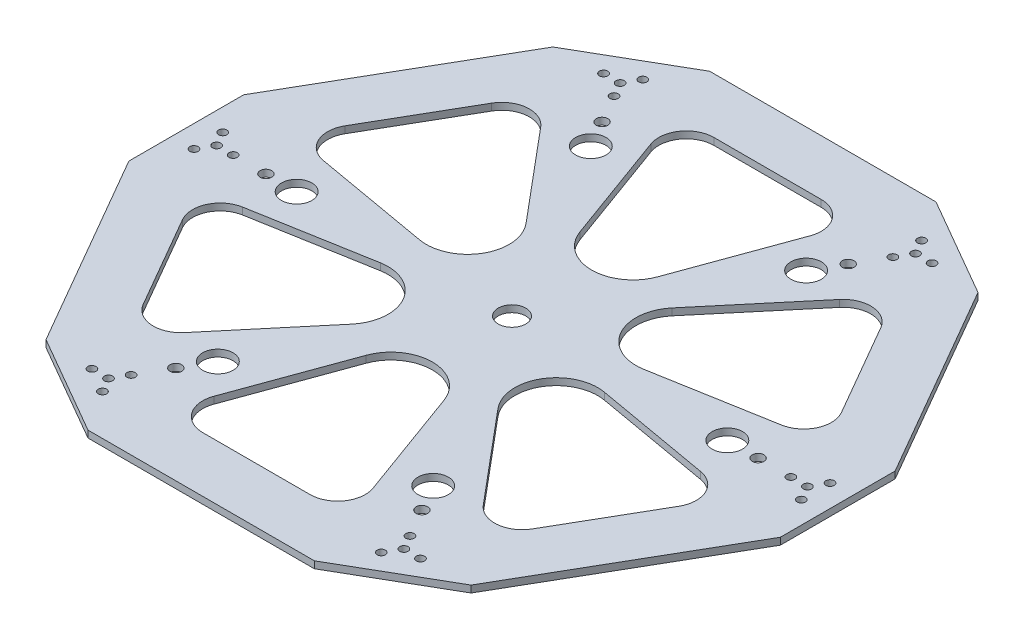
from build123d import *

# Parameters (mm, degrees)
SKETCH_2_R               = 5
EXTRUDE_1_DEPTH          = 2.5
EXTRUDE_2_DEPTH          = 2.5
SKETCH_5_R               = 2.1
CUT_EXTRUDE_2_DEPTH      = 10
CUT_EXTRUDE_3_DEPTH      = 10
EXTRUDE_3_DEPTH          = 2.5
SKETCH_11_R              = 1.5
CUT_EXTRUDE_4_DEPTH      = 167.76405488
PATTERN_CIRCULAR_1_COUNT = 6
CUT_EXTRUDE_12_DEPTH     = 2.5
SKETCH_13_R              = 5.5
CUT_EXTRUDE_13_DEPTH     = 10
SKETCH_14_R              = 10
CUT_EXTRUDE_14_DEPTH     = 10
PATTERN_CIRCULAR_2_COUNT = 6


with BuildPart() as part:
    # 草图2 → 凸台-拉伸1 (new body)
    with BuildSketch(Plane(origin=(0, 0, 0), x_dir=(1, 0, 0), z_dir=(0, 1, 0))):
        Polygon((-54.5, 0), (-27.25, -47.198384506), (27.25, -47.198384506), (54.5, 0), (27.25, 47.198384506), (-27.25, 47.198384506), align=None)
        with Locations(Location((0, 0, 0), (0, 0, 270))):
            Circle(SKETCH_2_R, mode=Mode.SUBTRACT)
    extrude(amount=EXTRUDE_1_DEPTH)

    # 草图4 → 凸台-拉伸2 (add)
    with BuildSketch(Plane(origin=(0, 2.5, 0), x_dir=(1, 0, 0), z_dir=(0, 1, 0))):
        Polygon((-100.688021535, 0), (-50.344010768, -87.198384506), (50.344010768, -87.198384506), (100.688021535, 0), (50.344010768, 87.198384506), (-50.344010768, 87.198384506), align=None)
        Polygon((-54.5, 0), (-27.25, -47.198384506), (27.25, -47.198384506), (54.5, 0), (27.25, 47.198384506), (-27.25, 47.198384506), align=None, mode=Mode.SUBTRACT)
    extrude(amount=-EXTRUDE_2_DEPTH)

    # 草图5 → 切除-拉伸2 (cut)
    with BuildSketch(Plane(origin=(0, 2.5, 0), x_dir=(1, 0, 0), z_dir=(0, 1, 0))):
        with Locations(Location((-44.570508076, 77.198384506, 0), (0, 0, 270))):
            Circle(SKETCH_5_R)
        with Locations(Location((44.570508076, 77.198384506, 0), (0, 0, 270))):
            Circle(SKETCH_5_R)
        with Locations(Location((89.141016151, 0, 0), (0, 0, 270))):
            Circle(SKETCH_5_R)
        with Locations(Location((44.570508076, -77.198384506, 0), (0, 0, 270))):
            Circle(SKETCH_5_R)
        with Locations(Location((-44.570508076, -77.198384506, 0), (0, 0, 270))):
            Circle(SKETCH_5_R)
        with Locations(Location((-89.141016151, 0, 0), (0, 0, 270))):
            Circle(SKETCH_5_R)
    extrude(amount=-CUT_EXTRUDE_2_DEPTH, mode=Mode.SUBTRACT)

    # 草图8 → 切除-拉伸3 (cut)
    with BuildSketch(Plane(origin=(0, 2.5, 0), x_dir=(1, 0, 0), z_dir=(0, 1, 0))):
        with BuildLine():
            ThreePointArc((-53.230762082, 82.198384561), (-49.57050806, 85.858638553), (-44.570508102, 87.198384506))
            Line((-44.570508102, 87.198384506), (-50.344010768, 87.198384506))
            Line((-50.344010768, 87.198384506), (-53.230762082, 82.198384561))
        make_face()
        with BuildLine():
            ThreePointArc((-44.570508102, 87.198384506), (-41.187416216, 86.608734631), (-38.203292274, 84.909322383))
            ThreePointArc((-38.203292274, 84.909322383), (-39.526928503, 86.034926004), (-40.817417051, 87.198384506))
            Line((-40.817417051, 87.198384506), (-44.570508102, 87.198384506))
        make_face()
        with BuildLine():
            ThreePointArc((-55.107307626, 78.948112336), (-54.74496737, 77.248787672), (-54.431984218, 75.539683719))
            ThreePointArc((-54.431984218, 75.539683719), (-54.411656187, 78.973716546), (-53.230762082, 82.198384561))
            Line((-53.230762082, 82.198384561), (-55.107307626, 78.948112336))
        make_face()
        with BuildLine():
            ThreePointArc((-40.817417051, 87.198384506), (-39.526928503, 86.034926004), (-38.203292274, 84.909322383))
            ThreePointArc((-38.203292274, 84.909322383), (1.369e-06, 71.174951736), (38.203294385, 84.909324126))
            ThreePointArc((38.203294385, 84.909324126), (39.526929533, 86.034926906), (40.817417051, 87.198384506))
            Line((40.817417051, 87.198384506), (-40.817417051, 87.198384506))
        make_face()
        with BuildLine():
            ThreePointArc((60, 131.174951736), (-23.989111873, 186.17061076), (-40.817417051, 87.198384506))
            Line((-40.817417051, 87.198384506), (40.817417051, 87.198384506))
            ThreePointArc((40.817417051, 87.198384506), (54.995659024, 107.185839862), (60, 131.174951736))
        make_face()
        with BuildLine():
            ThreePointArc((55.107307626, 78.948112336), (54.744967326, 77.248787452), (54.431984143, 75.539683277))
            ThreePointArc((54.431984143, 75.539683277), (61.639316282, 35.587475927), (92.635276654, 9.369639456))
            ThreePointArc((92.635276654, 9.369639456), (94.271895943, 8.78613873), (95.924724677, 8.25027217))
            Line((95.924724677, 8.25027217), (55.107307626, 78.948112336))
        make_face()
        with BuildLine():
            ThreePointArc((173.600840543, 65.587475868), (120.323489759, 125.209669618), (55.107307626, 78.948112336))
            Line((55.107307626, 78.948112336), (95.924724677, 8.25027217))
            ThreePointArc((95.924724677, 8.25027217), (149.23392242, 17.314466059), (173.600840543, 65.587475868))
        make_face()
        with BuildLine():
            ThreePointArc((95.924724677, -8.25027217), (94.271895905, -8.786138743), (92.635276579, -9.369639484))
            ThreePointArc((92.635276579, -9.369639484), (61.639316268, -35.587475951), (54.431984139, -75.539683251))
            ThreePointArc((54.431984139, -75.539683251), (54.744967324, -77.248787439), (55.107307626, -78.948112336))
            Line((55.107307626, -78.948112336), (95.924724677, -8.25027217))
        make_face()
        with BuildLine():
            ThreePointArc((173.600840543, -65.587475868), (149.23392242, -17.314466059), (95.924724677, -8.25027217))
            Line((95.924724677, -8.25027217), (55.107307626, -78.948112336))
            ThreePointArc((55.107307626, -78.948112336), (120.323489759, -125.209669618), (173.600840543, -65.587475868))
        make_face()
        with BuildLine():
            ThreePointArc((40.817417051, -87.198384506), (39.526928757, -86.034926226), (38.203292795, -84.909322813))
            ThreePointArc((38.203292795, -84.909322813), (2.5e-07, -71.174951736), (-38.20329241, -84.909322495))
            ThreePointArc((-38.20329241, -84.909322495), (-39.52692857, -86.034926062), (-40.817417051, -87.198384506))
            Line((-40.817417051, -87.198384506), (40.817417051, -87.198384506))
        make_face()
        with BuildLine():
            ThreePointArc((60, -131.174951736), (54.995659024, -107.185839862), (40.817417051, -87.198384506))
            Line((40.817417051, -87.198384506), (-40.817417051, -87.198384506))
            ThreePointArc((-40.817417051, -87.198384506), (-23.989111873, -186.17061076), (60, -131.174951736))
        make_face()
        with BuildLine():
            ThreePointArc((-53.600840543, -65.587475868), (-64.316290117, -31.367115127), (-92.635276851, -9.369639383))
            ThreePointArc((-92.635276851, -9.369639383), (-94.271896042, -8.786138696), (-95.924724677, -8.25027217))
            Line((-95.924724677, -8.25027217), (-55.107307626, -78.948112336))
            ThreePointArc((-55.107307626, -78.948112336), (-54.744967314, -77.248787392), (-54.431984123, -75.539683157))
            ThreePointArc((-54.431984123, -75.539683157), (-53.808987481, -70.580902286), (-53.600840543, -65.587475868))
        make_face()
        with BuildLine():
            Line((-55.107307626, -78.948112336), (-95.924724677, -8.25027217))
            ThreePointArc((-95.924724677, -8.25027217), (-165.56236477, -95.587475868), (-55.107307626, -78.948112336))
        make_face()
        with BuildLine():
            ThreePointArc((-53.600840543, 65.587475868), (-53.808987505, 70.58090257), (-54.431984218, 75.539683719))
            ThreePointArc((-54.431984218, 75.539683719), (-54.74496737, 77.248787672), (-55.107307626, 78.948112336))
            Line((-55.107307626, 78.948112336), (-95.924724677, 8.25027217))
            ThreePointArc((-95.924724677, 8.25027217), (-94.271896068, 8.786138688), (-92.635276901, 9.369639364))
            ThreePointArc((-92.635276901, 9.369639364), (-64.316290132, 31.367115105), (-53.600840543, 65.587475868))
        make_face()
        with BuildLine():
            Line((-95.924724677, 8.25027217), (-55.107307626, 78.948112336))
            ThreePointArc((-55.107307626, 78.948112336), (-165.56236477, 95.587475868), (-95.924724677, 8.25027217))
        make_face()
        with BuildLine():
            Line((50.344010768, 87.198384506), (44.570508076, 87.198384506))
            ThreePointArc((44.570508076, 87.198384506), (49.570508048, 85.85863856), (53.230762082, 82.198384561))
            Line((53.230762082, 82.198384561), (50.344010768, 87.198384506))
        make_face()
        with BuildLine():
            ThreePointArc((40.817417051, 87.198384506), (39.526929533, 86.034926906), (38.203294385, 84.909324126))
            ThreePointArc((38.203294385, 84.909324126), (41.187417492, 86.60873509), (44.570508076, 87.198384506))
            Line((44.570508076, 87.198384506), (40.817417051, 87.198384506))
        make_face()
        with BuildLine():
            ThreePointArc((54.570508076, 77.198384506), (54.535816919, 76.366146763), (54.431984143, 75.539683277))
            ThreePointArc((54.431984143, 75.539683277), (54.744967326, 77.248787452), (55.107307626, 78.948112336))
            Line((55.107307626, 78.948112336), (53.230762082, 82.198384561))
            ThreePointArc((53.230762082, 82.198384561), (54.22976633, 79.786574988), (54.570508076, 77.198384506))
        make_face()
        with BuildLine():
            ThreePointArc((95.924724677, 8.25027217), (94.271895943, 8.78613873), (92.635276654, 9.369639456))
            ThreePointArc((92.635276654, 9.369639456), (95.599072657, 7.635018413), (97.801270256, 4.999999885))
            Line((97.801270256, 4.999999885), (95.924724677, 8.25027217))
        make_face()
        with BuildLine():
            Line((100.688021535, 0), (97.801270256, 4.999999885))
            ThreePointArc((97.801270256, 4.999999885), (98.800274431, 2.588190387), (99.141016151, 0))
            ThreePointArc((99.141016151, 0), (98.800274434, -2.588190377), (97.801270266, -4.999999867))
            Line((97.801270266, -4.999999867), (100.688021535, 0))
        make_face()
        with BuildLine():
            ThreePointArc((97.801270266, -4.999999867), (95.599072634, -7.635018433), (92.635276579, -9.369639484))
            ThreePointArc((92.635276579, -9.369639484), (94.271895905, -8.786138743), (95.924724677, -8.25027217))
            Line((95.924724677, -8.25027217), (97.801270266, -4.999999867))
        make_face()
        with BuildLine():
            ThreePointArc((55.107307626, -78.948112336), (54.744967324, -77.248787439), (54.431984139, -75.539683251))
            ThreePointArc((54.431984139, -75.539683251), (54.535816918, -76.36614675), (54.570508076, -77.198384506))
            ThreePointArc((54.570508076, -77.198384506), (54.22976633, -79.786574988), (53.230762082, -82.198384561))
            Line((53.230762082, -82.198384561), (55.107307626, -78.948112336))
        make_face()
        with BuildLine():
            ThreePointArc((44.57050771, -87.198384506), (41.187416349, -86.608734679), (38.203292795, -84.909322813))
            ThreePointArc((38.203292795, -84.909322813), (39.526928757, -86.034926226), (40.817417051, -87.198384506))
            Line((40.817417051, -87.198384506), (44.57050771, -87.198384506))
        make_face()
        with BuildLine():
            Line((50.344010768, -87.198384506), (53.230762082, -82.198384561))
            ThreePointArc((53.230762082, -82.198384561), (49.57050789, -85.858638651), (44.57050771, -87.198384506))
            Line((44.57050771, -87.198384506), (50.344010768, -87.198384506))
        make_face()
        with BuildLine():
            ThreePointArc((-53.230762265, -82.198384244), (-54.41165627, -78.973716086), (-54.431984123, -75.539683157))
            ThreePointArc((-54.431984123, -75.539683157), (-54.744967314, -77.248787392), (-55.107307626, -78.948112336))
            Line((-55.107307626, -78.948112336), (-53.230762265, -82.198384244))
        make_face()
        with BuildLine():
            ThreePointArc((-44.570508076, -87.198384506), (-49.570508207, -85.858638468), (-53.230762265, -82.198384244))
            Line((-53.230762265, -82.198384244), (-50.344010768, -87.198384506))
            Line((-50.344010768, -87.198384506), (-44.570508076, -87.198384506))
        make_face()
        with BuildLine():
            ThreePointArc((-40.817417051, -87.198384506), (-39.52692857, -86.034926062), (-38.20329241, -84.909322495))
            ThreePointArc((-38.20329241, -84.909322495), (-41.187416286, -86.608734656), (-44.570508076, -87.198384506))
            Line((-44.570508076, -87.198384506), (-40.817417051, -87.198384506))
        make_face()
        with BuildLine():
            ThreePointArc((-97.801270363, -4.999999699), (-99.141016151, 2.462e-06), (-97.801267901, 5.000003963))
            Line((-97.801267901, 5.000003963), (-100.688021535, 0))
            Line((-100.688021535, 0), (-97.801270363, -4.999999699))
        make_face()
        with BuildLine():
            ThreePointArc((-97.801267901, 5.000003963), (-95.59907096, 7.635019849), (-92.635276901, 9.369639364))
            ThreePointArc((-92.635276901, 9.369639364), (-94.271896068, 8.786138688), (-95.924724677, 8.25027217))
            Line((-95.924724677, 8.25027217), (-97.801267901, 5.000003963))
        make_face()
        with BuildLine():
            ThreePointArc((-95.924724677, -8.25027217), (-94.271896042, -8.786138696), (-92.635276851, -9.369639383))
            ThreePointArc((-92.635276851, -9.369639383), (-95.599072819, -7.635018276), (-97.801270363, -4.999999699))
            Line((-97.801270363, -4.999999699), (-95.924724677, -8.25027217))
        make_face()
    extrude(amount=-CUT_EXTRUDE_3_DEPTH, mode=Mode.SUBTRACT)

    # 草图10 → 凸台-拉伸3 (add)
    with BuildSketch(Plane(origin=(0, 2.5, 0), x_dir=(1, 0, 0), z_dir=(0, 1, 0))):
        Polygon((-72, 100.458946839), (-123, 12.124355653), (-123, -12.124355653), (-72, -100.458946839), (-51, -112.583302492), (51, -112.583302492), (72, -100.458946839), (123, -12.124355653), (123, 12.124355653), (72, 100.458946839), (51, 112.583302492), (-51, 112.583302492), align=None)
        with BuildLine():
            ThreePointArc((-54.431984142, 75.539683272), (-49.570508076, 85.858638544), (-38.203292636, 84.909322682))
            ThreePointArc((-38.203292636, 84.909322682), (0, 71.174951736), (38.203292636, 84.909322682))
            ThreePointArc((38.203292636, 84.909322682), (49.570508076, 85.858638544), (54.431984142, 75.539683272))
            ThreePointArc((54.431984142, 75.539683272), (61.639316316, 35.587475868), (92.635276779, 9.36963941))
            ThreePointArc((92.635276779, 9.36963941), (99.141016151, 0), (92.635276779, -9.36963941))
            ThreePointArc((92.635276779, -9.36963941), (61.639316316, -35.587475868), (54.431984142, -75.539683272))
            ThreePointArc((54.431984142, -75.539683272), (49.570508076, -85.858638544), (38.203292636, -84.909322682))
            ThreePointArc((38.203292636, -84.909322682), (0, -71.174951736), (-38.203292636, -84.909322682))
            ThreePointArc((-38.203292636, -84.909322682), (-49.570508076, -85.858638544), (-54.431984142, -75.539683272))
            ThreePointArc((-54.431984142, -75.539683272), (-61.639316316, -35.587475868), (-92.635276779, -9.36963941))
            ThreePointArc((-92.635276779, -9.36963941), (-99.141016151, 0), (-92.635276779, 9.36963941))
            ThreePointArc((-92.635276779, 9.36963941), (-61.639316316, 35.587475868), (-54.431984142, 75.539683272))
        make_face(mode=Mode.SUBTRACT)
    extrude(amount=-EXTRUDE_3_DEPTH)

    # 草图11 → 切除-拉伸4 (cut, through all)
    with BuildSketch(Plane(origin=(0, 2.5, 0), x_dir=(1, 0, 0), z_dir=(0, 1, 0))):
        with Locations(Location((-107, 0, 0), (0, 0, 270))):
            Circle(SKETCH_11_R)
        with Locations(Location((-101, 0, 0), (0, 0, 270))):
            Circle(SKETCH_11_R)
        with Locations(Location((-110, -5.196152423, 0), (0, 0, 270))):
            Circle(SKETCH_11_R)
        with Locations(Location((-110, 5.196152423, 0), (0, 0, 270))):
            Circle(SKETCH_11_R)
    cut_extrude_4 = extrude(amount=-CUT_EXTRUDE_4_DEPTH, mode=Mode.SUBTRACT)

    # 阵列(圆周)1: 切除-拉伸4 ×6 about axis
    pattern_circular_1_axis = Axis((0, 0, 0), (0, 1, 0))
    for i in range(1, PATTERN_CIRCULAR_1_COUNT):
        add(cut_extrude_4.rotate(pattern_circular_1_axis, i * 360 / PATTERN_CIRCULAR_1_COUNT), mode=Mode.SUBTRACT)

    # 草图12 → 切除-拉伸12 (cut)
    with BuildSketch(Plane(origin=(0, 2.5, 0), x_dir=(1, 0, 0), z_dir=(0, 1, 0))):
        Polygon((-145.895993517, 84.233091131), (-145.895993517, -84.233091131), (0, -168.466182261), (145.895993517, -84.233091131), (145.895993517, 84.233091131), (0, 168.466182261), align=None)
        Polygon((-118, 68.127331764), (-118, -68.127331764), (0, -136.254663529), (118, -68.127331764), (118, 68.127331764), (0, 136.254663529), align=None, mode=Mode.SUBTRACT)
    extrude(amount=-CUT_EXTRUDE_12_DEPTH, mode=Mode.SUBTRACT)

    # 草图13 → 切除-拉伸13 (cut)
    with BuildSketch(Plane(origin=(0, 2.5, 0), x_dir=(1, 0, 0), z_dir=(0, 1, 0))):
        with Locations(Location((-78, 0, 0), (0, 0, 270))):
            Circle(SKETCH_13_R)
        with Locations(Location((-39, 67.549981495, 0), (0, 0, 270))):
            Circle(SKETCH_13_R)
        with Locations(Location((39, 67.549981495, 0), (0, 0, 270))):
            Circle(SKETCH_13_R)
        with Locations(Location((78, 0, 0), (0, 0, 270))):
            Circle(SKETCH_13_R)
        with Locations(Location((39, -67.549981495, 0), (0, 0, 270))):
            Circle(SKETCH_13_R)
        with Locations(Location((-39, -67.549981495, 0), (0, 0, 270))):
            Circle(SKETCH_13_R)
    extrude(amount=-CUT_EXTRUDE_13_DEPTH, mode=Mode.SUBTRACT)

    # 草图14 → 切除-拉伸14 (cut)
    with BuildSketch(Plane(origin=(0, 2.5, 0), x_dir=(1, 0, 0), z_dir=(0, 1, 0))):
        with Locations((19.432278941, 82.583302492)):
            Circle(SKETCH_14_R)
        with BuildLine():
            Line((19.432278941, 92.583302492), (0, 92.583302492))
            Line((0, 92.583302492), (0, 58.835314539))
            ThreePointArc((0, 58.835314539), (10.606601718, 54.441916257), (15, 43.835314539))
            ThreePointArc((15, 43.835314539), (14.771881109, 41.229258418), (14.094462866, 38.702467716))
            Line((14.094462866, 38.702467716), (28.82858759, 79.161404807))
            ThreePointArc((28.82858759, 79.161404807), (11.240240829, 76.848277507), (19.432278941, 92.583302492))
        make_face()
        with BuildLine():
            ThreePointArc((-9.432278941, 82.583302492), (-17.694907774, 72.735381827), (-28.828587227, 79.161403809))
            Line((-28.828587227, 79.161403809), (-14.09446245, 38.702466573))
            ThreePointArc((-14.09446245, 38.702466573), (-12.288057607, 52.437851389), (0, 58.835314539))
            Line((0, 58.835314539), (0, 92.583302492))
            Line((0, 92.583302492), (-19.432278941, 92.583302492))
            ThreePointArc((-19.432278941, 92.583302492), (-12.361211129, 89.654370304), (-9.432278941, 82.583302492))
        make_face()
        with Locations((-19.432278941, 82.583302492)):
            Circle(SKETCH_14_R)
        with BuildLine():
            ThreePointArc((0, 58.835314539), (-12.288057607, 52.437851389), (-14.09446245, 38.702466573))
            ThreePointArc((-14.09446245, 38.702466573), (-8.60253685, 31.547256932), (0, 28.835314539))
            Line((0, 28.835314539), (0, 58.835314539))
        make_face()
        with BuildLine():
            ThreePointArc((15, 43.835314539), (10.606601718, 54.441916257), (0, 58.835314539))
            Line((0, 58.835314539), (0, 28.835314539))
            ThreePointArc((0, 28.835314539), (8.602537348, 31.547257281), (14.094462866, 38.702467716))
            ThreePointArc((14.094462866, 38.702467716), (14.771881109, 41.229258418), (15, 43.835314539))
        make_face()
    cut_extrude_14 = extrude(amount=-CUT_EXTRUDE_14_DEPTH, mode=Mode.SUBTRACT)

    # 阵列(圆周)2: 切除-拉伸14 ×6 about axis
    pattern_circular_2_axis = Axis((0, 0, 0), (0, 1, 0))
    for i in range(1, PATTERN_CIRCULAR_2_COUNT):
        add(cut_extrude_14.rotate(pattern_circular_2_axis, i * 360 / PATTERN_CIRCULAR_2_COUNT), mode=Mode.SUBTRACT)


solid = part.part
